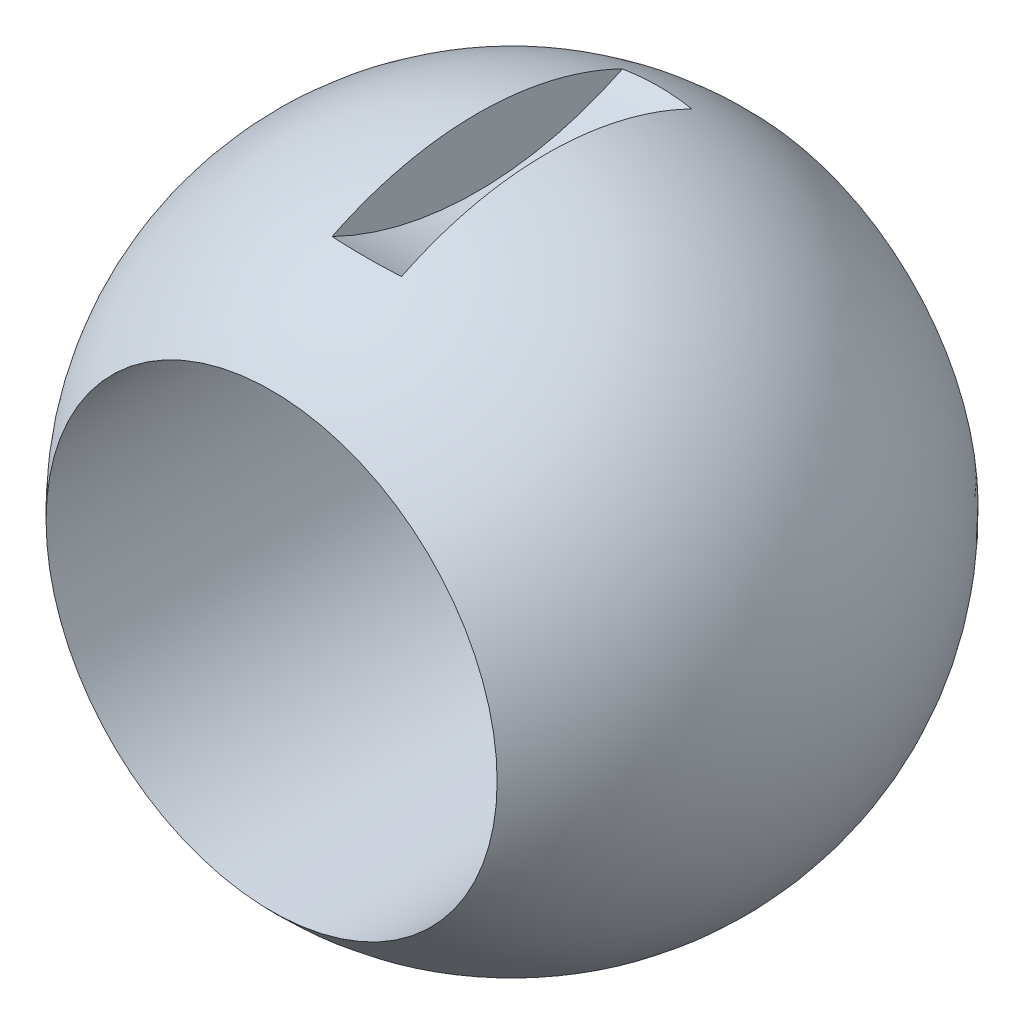
from build123d import *

# Parameters (mm, degrees)
WYTNIJ_WYCI_GNI_CIE1_DEPTH      = 33.908965344
WYTNIJ_WYCI_GNI_CIE1_DEPTH_BACK = 33.908965344
SZKIC2_R                        = 13
WYTNIJ_WYCI_GNI_CIE4_DEPTH      = 2
WYTNIJ_WYCI_GNI_CIE4_DEPTH_BACK = 2
SZKIC5_R                        = 19


with BuildPart() as part:
    # Szkic1 → Obrót1 (revolve)
    with BuildSketch(Plane.XY):
        with BuildLine():
            ThreePointArc((0, -19), (19, 0), (0, 19))
            Line((0, 19), (0, -19))
        make_face()
    revolve(axis=Axis((0, -27.54752711, 0), (0, 1, 0)))

    # Szkic2 → Wytnij-wyciągnięcie1 (cut, two sides: drawn at the far end of the back side and taken through both)
    with BuildSketch(Plane.XY.offset(-WYTNIJ_WYCI_GNI_CIE1_DEPTH_BACK)):
        Circle(SZKIC2_R)
    extrude(amount=WYTNIJ_WYCI_GNI_CIE1_DEPTH + WYTNIJ_WYCI_GNI_CIE1_DEPTH_BACK, mode=Mode.SUBTRACT)

    # Szkic5 → Wytnij-wyciągnięcie4 (cut, two sides: drawn at the far end of the back side and taken through both)
    with BuildSketch(Plane(origin=(0, 0, 0), x_dir=(0, 0, -1), z_dir=(1, 0, 0)).offset(-WYTNIJ_WYCI_GNI_CIE4_DEPTH_BACK)):
        with Locations((0, 34)):
            Circle(SZKIC5_R)
    extrude(amount=WYTNIJ_WYCI_GNI_CIE4_DEPTH + WYTNIJ_WYCI_GNI_CIE4_DEPTH_BACK, mode=Mode.SUBTRACT)


solid = part.part
